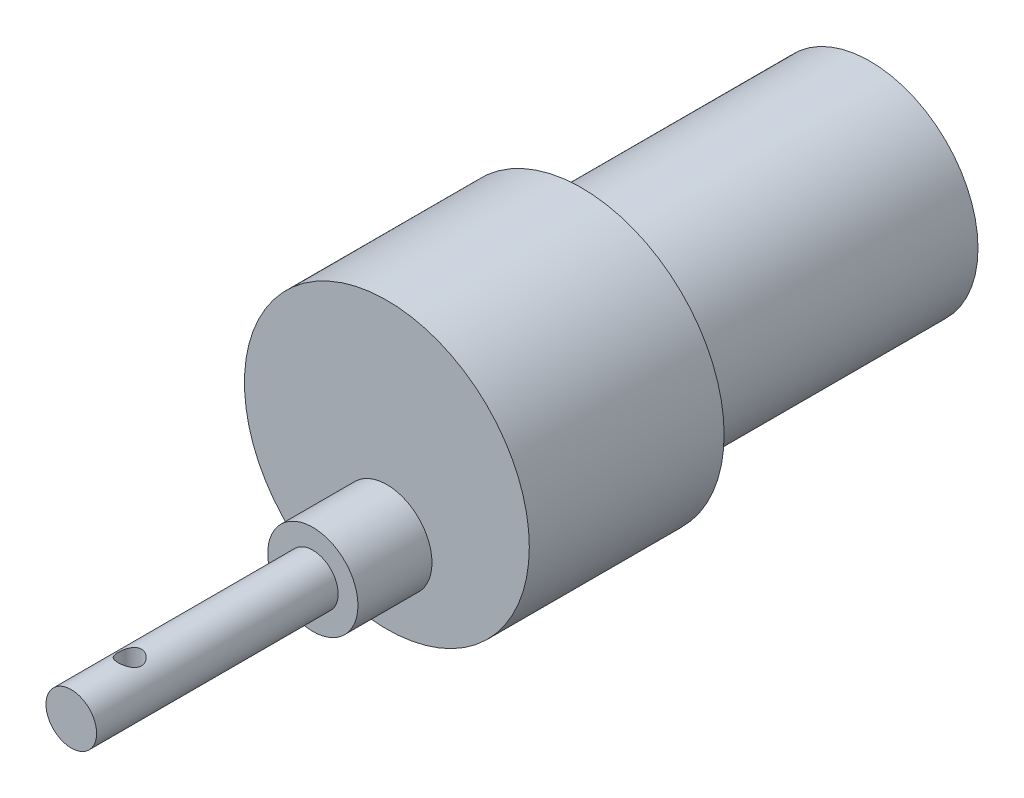
from build123d import *

# Parameters (mm, degrees)
SKETCH6_R           = 13.86
BOSS_EXTRUDE4_DEPTH = 62
SKETCH7_R           = 18.28
BOSS_EXTRUDE5_DEPTH = 25
SKETCH8_R           = 5.79
BOSS_EXTRUDE6_DEPTH = 9.5
SKETCH9_R           = 3.25
BOSS_EXTRUDE7_DEPTH = 31
SKETCH13_R          = 1.5
CUT_EXTRUDE1_DEPTH  = 20


with BuildPart() as part:
    # Sketch6 → Boss-Extrude4 (new body)
    with BuildSketch(Plane.XY):
        Circle(SKETCH6_R)
    extrude(amount=BOSS_EXTRUDE4_DEPTH)

    # Sketch7 → Boss-Extrude5 (add)
    with BuildSketch(Plane.XY.offset(37)):
        Circle(SKETCH7_R)
    extrude(amount=BOSS_EXTRUDE5_DEPTH)

    # Sketch8 → Boss-Extrude6 (add)
    with BuildSketch(Plane.XY.offset(62)):
        with Locations((0, -7.99)):
            Circle(SKETCH8_R)
    extrude(amount=BOSS_EXTRUDE6_DEPTH)

    # Sketch9 → Boss-Extrude7 (add)
    with BuildSketch(Plane.XY.offset(71.5)):
        with Locations((0, -7.99)):
            Circle(SKETCH9_R)
    extrude(amount=BOSS_EXTRUDE7_DEPTH)

    # Sketch13 → Cut-Extrude1 (cut)
    with BuildSketch(Plane(origin=(0, 0, 0), x_dir=(1, 0, 0), z_dir=(0, 1, 0))):
        with Locations(Location((0, -95, 0), (0, 0, 270))):
            Circle(SKETCH13_R)
    extrude(amount=-CUT_EXTRUDE1_DEPTH, mode=Mode.SUBTRACT)


solid = part.part
